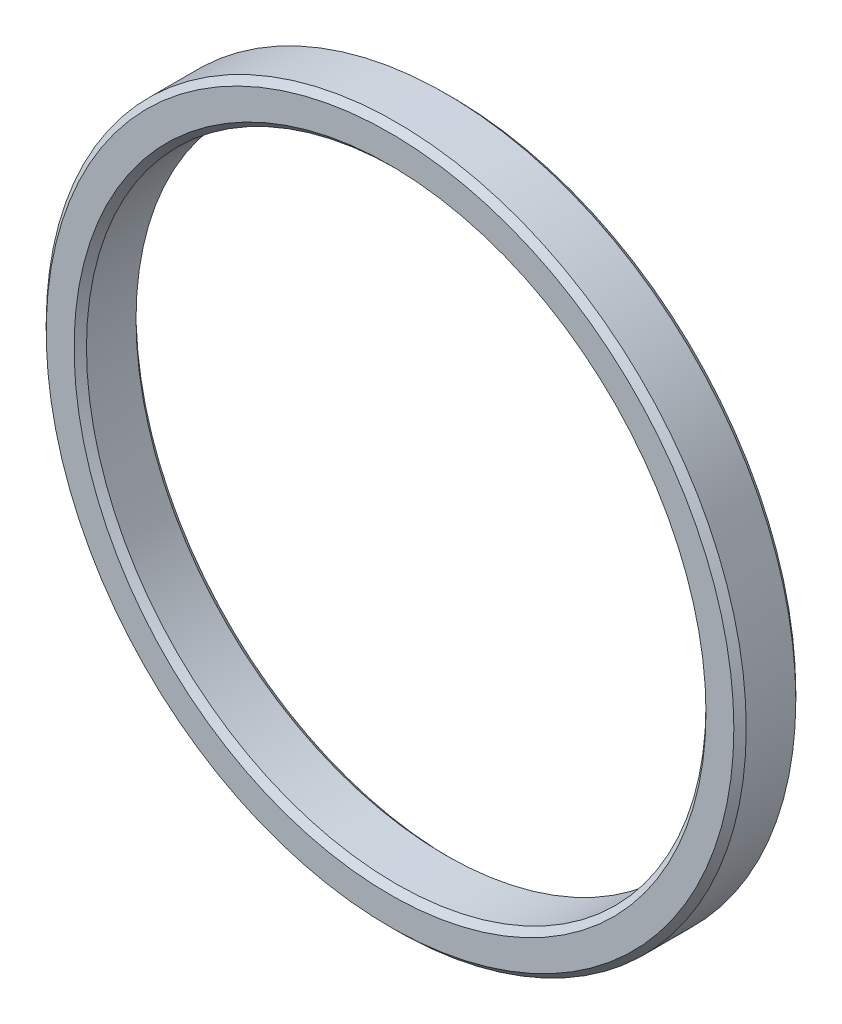
from build123d import *

# Parameters (mm, degrees)
SKETCH1_R      = 113
SKETCH1_R_2    = 100
EXTRUDE1_DEPTH = 10
CHAMFER1_SIZE  = 2


with BuildPart() as part:
    # Sketch1 → Extrude1 (new, symmetric)
    with BuildSketch(Plane.XY):
        Circle(SKETCH1_R)
        Circle(SKETCH1_R_2, mode=Mode.SUBTRACT)
    extrude(amount=EXTRUDE1_DEPTH, both=True)

    # Chamfer1
    chamfer1_edges = [part.edges().sort_by_distance(p)[0] for p in [
        (-113, 0, -10),
        (-113, 0, 10),
        (-100, 0, -10),
        (-100, 0, 10),
    ]]
    chamfer(chamfer1_edges, length=CHAMFER1_SIZE)


solid = part.part
